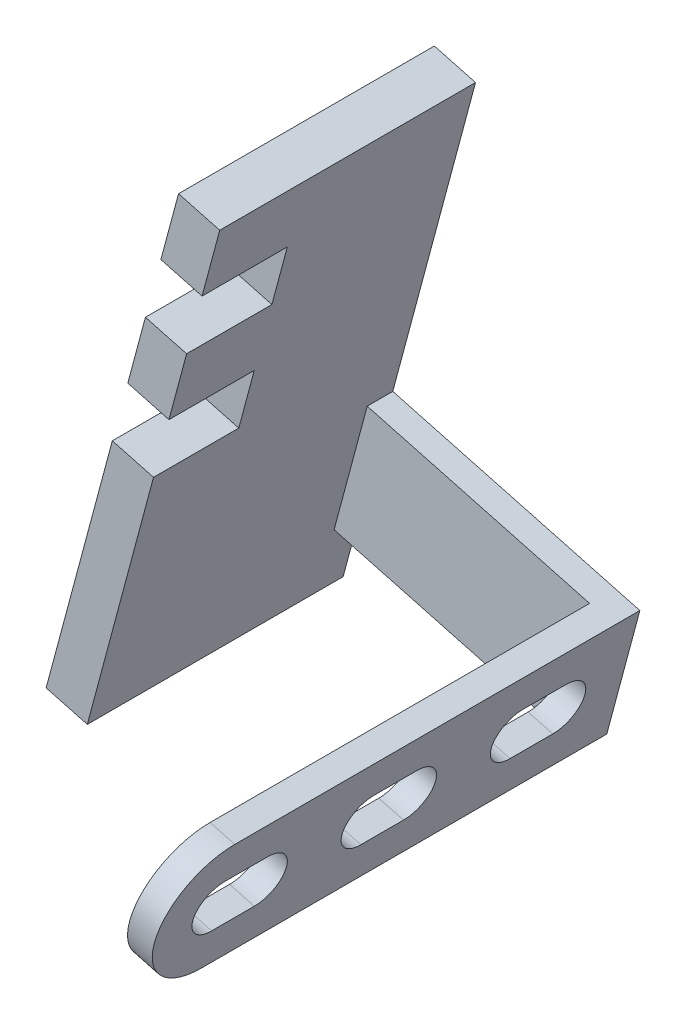
from build123d import *

# Parameters (mm, degrees)
BOSS_EXTRUDE1_DEPTH = 30
SKETCH3_W           = 20
SKETCH3_H           = 14
CUT_EXTRUDE1_DEPTH  = 60
BOSS_EXTRUDE2_DEPTH = 15
BOSS_EXTRUDE3_DEPTH = 6
CUT_EXTRUDE2_DEPTH  = 30


with BuildPart() as part:
    # Sketch2 → Boss-Extrude1 (new, symmetric)
    with BuildSketch(Plane.XY):
        Polygon((-9.659258263, 2.588190451), (0, 0), (31.058285412, 115.911099155), (21.399027149, 118.499289606), align=None)
    extrude(amount=BOSS_EXTRUDE1_DEPTH, both=True)

    # Sketch3 → Cut-Extrude1 (cut)
    with BuildSketch(Plane(origin=(0, 0, 0), x_dir=(0, 0, -1), z_dir=(0.9659258262890692, -0.25881904510251785, 0))):
        with Locations((-20, 97)):
            Rectangle(SKETCH3_W, SKETCH3_H)
        with Locations((-20, 67)):
            Rectangle(SKETCH3_W, SKETCH3_H)
    extrude(amount=-CUT_EXTRUDE1_DEPTH, mode=Mode.SUBTRACT)

    # Sketch5 → Boss-Extrude2 (add, symmetric)
    with BuildSketch(Plane(origin=(7.764571353, 28.977774789, 0), x_dir=(-0.9659258262890692, 0.25881904510251746, 0), z_dir=(-0.25881904510251746, -0.9659258262890692, 0))):
        Polygon((0, 24), (-54, 24), (-54, -65), (-60, -65), (-60, 30), (0, 30), align=None)
    extrude(amount=BOSS_EXTRUDE2_DEPTH, both=True)

    # Sketch6 → Boss-Extrude3 (add)
    with BuildSketch(Plane(origin=(57.955549577, -15.529142706, 0), x_dir=(0, 0, -1), z_dir=(0.9659258262890692, -0.25881904510251746, 0))):
        with BuildLine():
            Line((-65, 45), (-65, 15))
            ThreePointArc((-65, 15), (-80, 30), (-65, 45))
        make_face()
    extrude(amount=-BOSS_EXTRUDE3_DEPTH)

    # Sketch7 → Cut-Extrude2 (cut)
    with BuildSketch(Plane(origin=(57.955549577, -15.529142706, 0), x_dir=(0, 0, -1), z_dir=(0.9659258262890692, -0.25881904510251746, 0))):
        with BuildLine():
            Line((-65, 36), (-55, 36))
            ThreePointArc((-55, 36), (-49, 30), (-55, 24))
            Line((-55, 24), (-65, 24))
            ThreePointArc((-65, 24), (-71, 30), (-65, 36))
        make_face()
        with BuildLine():
            Line((-30, 36), (-20, 36))
            ThreePointArc((-20, 36), (-14, 30), (-20, 24))
            Line((-20, 24), (-30, 24))
            ThreePointArc((-30, 24), (-36, 30), (-30, 36))
        make_face()
        with BuildLine():
            Line((5, 36), (15, 36))
            ThreePointArc((15, 36), (21, 30), (15, 24))
            Line((15, 24), (5, 24))
            ThreePointArc((5, 24), (-1, 30), (5, 36))
        make_face()
    extrude(amount=-CUT_EXTRUDE2_DEPTH, mode=Mode.SUBTRACT)


solid = part.part
